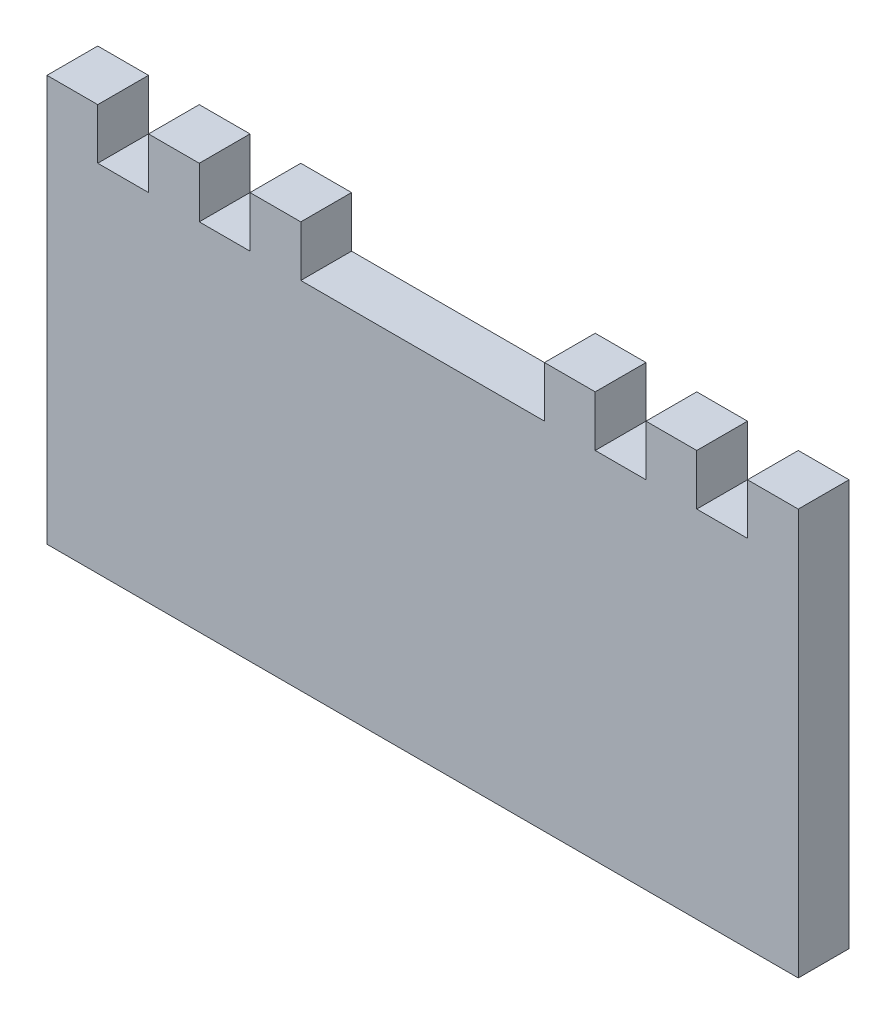
from build123d import *

# Parameters (mm, degrees)
BOSS_EXTRU_1_DEPTH = 5


with BuildPart() as part:
    # Esquisse1 → Boss.-Extru.1 (new body)
    with BuildSketch(Plane.XY):
        Polygon((-43.192826577, -9.581257513), (-67.192826577, -9.581257513), (-67.192826577, -4.581257513), (-72.192826577, -4.581257513), (-72.192826577, -9.581257513), (-77.192826577, -9.581257513), (-77.192826577, -4.581257513), (-82.192826577, -4.581257513), (-82.192826577, -9.581257513), (-87.192826577, -9.581257513), (-87.192826577, -4.581257513), (-92.192826577, -4.581257513), (-92.192826577, -44.581257513), (-18.192826577, -44.581257513), (-18.192826577, -4.581257513), (-23.192826577, -4.581257513), (-23.192826577, -9.581257513), (-28.192826577, -9.581257513), (-28.192826577, -4.581257513), (-33.192826577, -4.581257513), (-33.192826577, -9.581257513), (-38.192826577, -9.581257513), (-38.192826577, -4.581257513), (-43.192826577, -4.581257513), align=None)
    extrude(amount=BOSS_EXTRU_1_DEPTH)


solid = part.part
